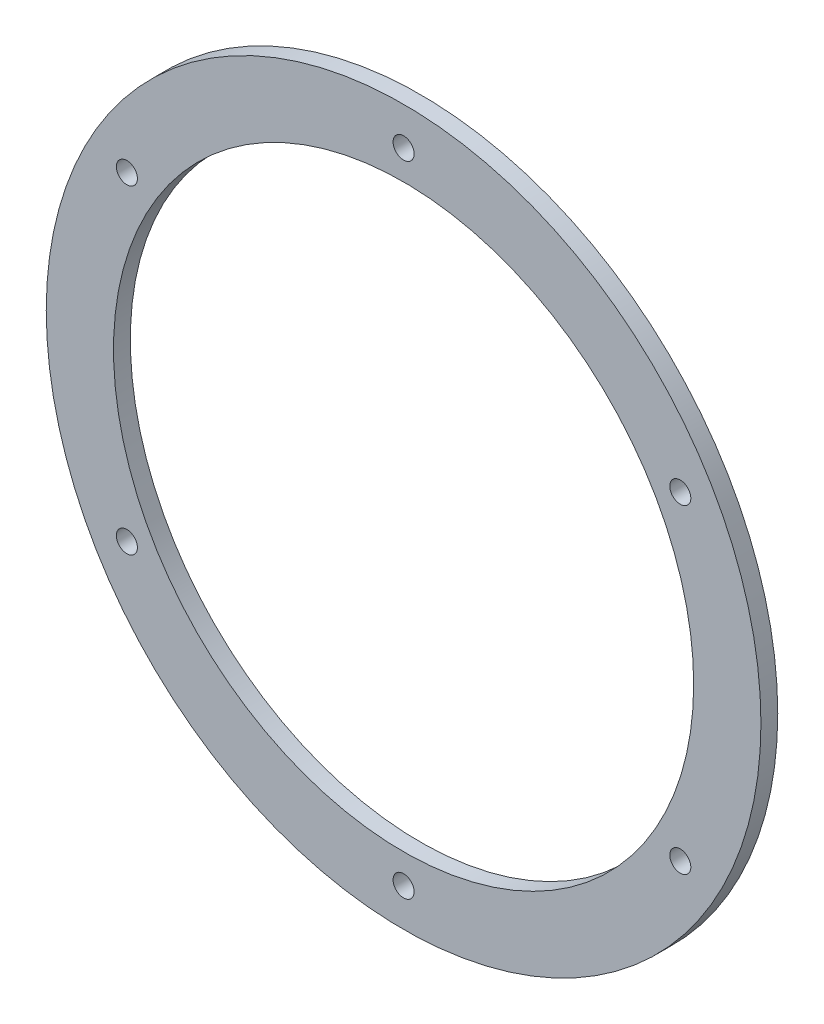
from build123d import *

# Parameters (mm, degrees)
SKETCH_1_R                 = 42.5
SKETCH_1_R_2               = 34.5
EXTRUDE_336_DEPTH          = 2
SKETCH_3_R                 = 1.25
CUT_EXTRUDE_486_DEPTH      = 61.137342808
PATTERN_CIRCULAR_525_COUNT = 6


with BuildPart() as part:
    # Эскиз1 → Extrude 336 (new body)
    with BuildSketch(Plane.XY):
        Circle(SKETCH_1_R)
        Circle(SKETCH_1_R_2, mode=Mode.SUBTRACT)
    extrude(amount=EXTRUDE_336_DEPTH)

    # Эскиз3 → Cut-Extrude 486 (cut, through all)
    with BuildSketch(Plane.XY.offset(2)):
        with Locations((0, 38)):
            Circle(SKETCH_3_R)
    cut_extrude_486 = extrude(amount=-CUT_EXTRUDE_486_DEPTH, mode=Mode.SUBTRACT)

    # Pattern Circular 525: Cut-Extrude 486 ×6 about axis
    pattern_circular_525_axis = Axis((0, 0, 0), (0, 0, 1))
    for i in range(1, PATTERN_CIRCULAR_525_COUNT):
        add(cut_extrude_486.rotate(pattern_circular_525_axis, i * 360 / PATTERN_CIRCULAR_525_COUNT), mode=Mode.SUBTRACT)


solid = part.part
